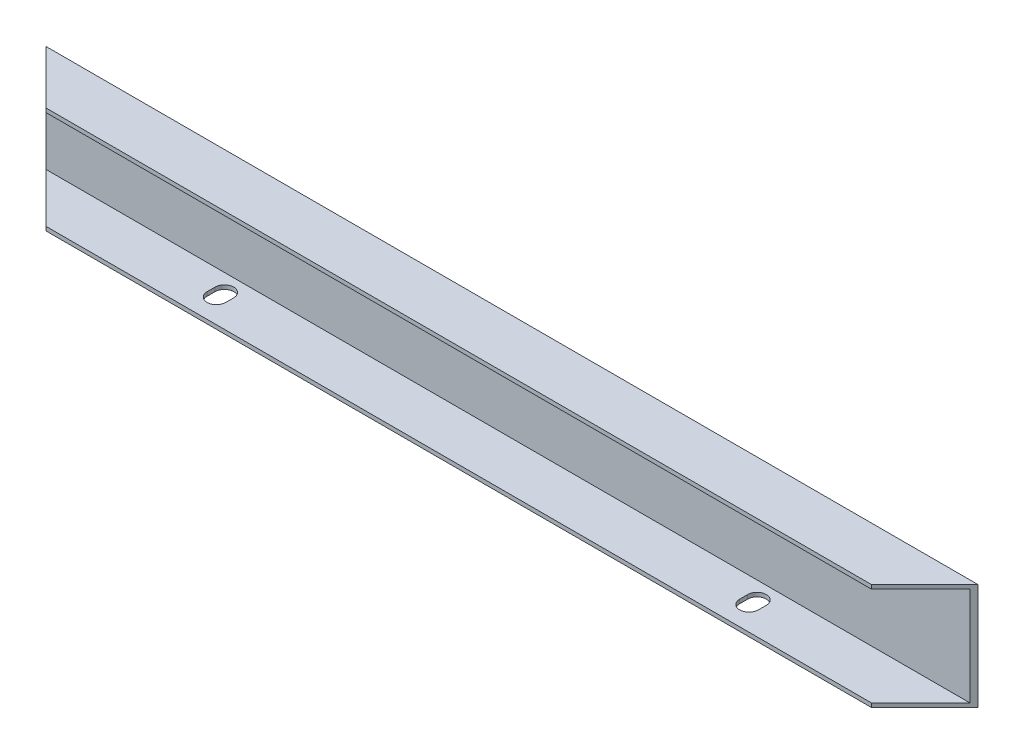
from build123d import *

# Parameters (mm, degrees)
RESSALTO_EXTRUS_O1_DEPTH = 175
CORTE_EXTRUS_O1_DEPTH    = 50
CORTE_EXTRUS_O2_DEPTH    = 1.5


with BuildPart() as part:
    # Esboço1 → Ressalto-extrusão1 (new, symmetric)
    with BuildSketch(Plane(origin=(0, 0, 0), x_dir=(0, 0, -1), z_dir=(1, 0, 0))):
        Polygon((0, 20), (0, -20), (-20, -20), (-20, -18.5), (-1.5, -18.5), (-1.5, 18.5), (-20, 18.5), (-20, 20), align=None)
    extrude(amount=RESSALTO_EXTRUS_O1_DEPTH, both=True)

    # Esboço2 → Corte-extrusão1 (cut, symmetric)
    with BuildSketch(Plane(origin=(0, 20, 0), x_dir=(1, 0, 0), z_dir=(0, 1, 0))):
        Polygon((-175, 0), (-155, -20), (-175, -20), align=None)
        Polygon((175, 0), (155, -20), (175, -20), align=None)
    extrude(amount=CORTE_EXTRUS_O1_DEPTH, both=True, mode=Mode.SUBTRACT)

    # Esboço3 → Corte-extrusão2 (cut)
    with BuildSketch(Plane.XZ.offset(20)):
        with BuildLine():
            Line((-103.5, 11), (-103.5, 8))
            ThreePointArc((-103.5, 8), (-100, 4.5), (-96.5, 8))
            Line((-96.5, 8), (-96.5, 11))
            ThreePointArc((-96.5, 11), (-100, 14.5), (-103.5, 11))
        make_face()
        with BuildLine():
            Line((96.5, 8), (96.5, 11))
            ThreePointArc((96.5, 11), (100, 14.5), (103.5, 11))
            Line((103.5, 11), (103.5, 8))
            ThreePointArc((103.5, 8), (100, 4.5), (96.5, 8))
        make_face()
    extrude(amount=-CORTE_EXTRUS_O2_DEPTH, mode=Mode.SUBTRACT)


solid = part.part
